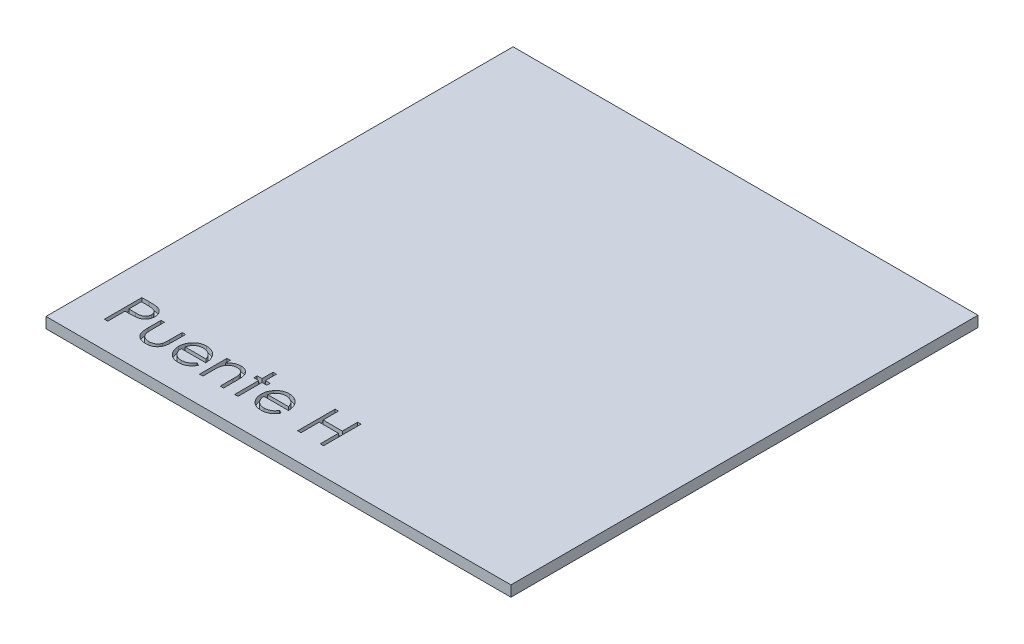
from build123d import *

# Parameters (mm, degrees)
SKETCH1_W           = 43.4
SKETCH1_H           = 43.6
BOSS_EXTRUDE1_DEPTH = 1
CUT_EXTRUDE1_DEPTH  = 0.5


with BuildPart() as part:
    # Sketch1 → Boss-Extrude1 (new body)
    with BuildSketch(Plane(origin=(0, 0, 0), x_dir=(1, 0, 0), z_dir=(0, 1, 0))):
        with Locations((21.7, 21.8)):
            Rectangle(SKETCH1_W, SKETCH1_H)
    extrude(amount=BOSS_EXTRUDE1_DEPTH)

    # Sketch2 → Cut-Extrude1 (cut)
    # profile 1 of 7: a face of its own
    with BuildSketch(Plane(origin=(0, 1, 0), x_dir=(1, 0, 0), z_dir=(0, 1, 0))):
        with BuildLine():
            Line((2.948717949, 6), (3.635116186, 6))
            add(Edge.make_bspline(
                [(3.635116186, 6), (3.682327092, 5.999948104), (3.772785285, 5.999848668), (3.902500341, 5.996833922), (4.020310072, 5.99280723), (4.125960453, 5.987225337), (4.219776551, 5.980628747), (4.301333851, 5.971376708), (4.371273407, 5.961716412), (4.413179857, 5.951895005), (4.432291667, 5.947415865)],
                knots=[0, 0, 0, 0, 1.415646017, 2.712440637, 3.8905458, 4.950247383, 5.884950622, 6.709939814, 7.411656543, 8, 8, 8, 8], degree=3))
            add(Edge.make_bspline(
                [(4.432291667, 5.947415865), (4.4564852, 5.940793916), (4.504302178, 5.927706054), (4.573203221, 5.90149233), (4.638757066, 5.870410165), (4.701188625, 5.834986225), (4.759730708, 5.793700661), (4.815256749, 5.748227043), (4.867276729, 5.697515475), (4.915498121, 5.642134735), (4.959782918, 5.583014525), (4.997912601, 5.519272295), (5.029839828, 5.451980992), (5.0572231, 5.381187421), (5.076931554, 5.306297097), (5.091778454, 5.227830385), (5.101202082, 5.145795695), (5.102104643, 5.089735827), (5.102564103, 5.061197917)],
                knots=[0, 0, 0, 0, 0.999701418, 1.975846123, 2.934577507, 3.890451536, 4.834027766, 5.787354733, 6.749476667, 7.726910423, 8.712836071, 9.690891519, 10.682875813, 11.679750201, 12.712814741, 13.765529915, 14.8625177, 16, 16, 16, 16], degree=3))
            add(Edge.make_bspline(
                [(5.102564103, 5.061197917), (5.102142678, 5.03242014), (5.101318132, 4.976114476), (5.091421847, 4.893741688), (5.078091655, 4.815023298), (5.057594603, 4.740133847), (5.03074893, 4.669518077), (4.999256877, 4.602096845), (4.961273346, 4.539017173), (4.917628517, 4.480050055), (4.869076922, 4.425140143), (4.815823984, 4.374685348), (4.758084692, 4.32898101), (4.696042543, 4.287924666), (4.629092695, 4.252468387), (4.558250541, 4.220711082), (4.482900325, 4.194040021), (4.430757811, 4.18000996), (4.404246795, 4.172876603)],
                knots=[0, 0, 0, 0, 1.121902311, 2.195077645, 3.232258892, 4.234102512, 5.217864754, 6.176164875, 7.132989551, 8.084763148, 9.034132444, 9.988522005, 10.94243251, 11.903244335, 12.886203696, 13.894208494, 14.929344452, 16, 16, 16, 16], degree=3))
            add(Edge.make_bspline(
                [(4.404246795, 4.172876603), (4.382319461, 4.168213621), (4.334264434, 4.157994427), (4.255121711, 4.14658597), (4.162976325, 4.13684837), (4.057954045, 4.129547232), (3.940149141, 4.123296864), (3.809497883, 4.11832877), (3.665743806, 4.115598916), (3.565472562, 4.115458123), (3.513120994, 4.115384615)],
                knots=[0, 0, 0, 0, 0.601384939, 1.31797006, 2.144135048, 3.087295005, 4.142315834, 5.309527816, 6.595305764, 8, 8, 8, 8], degree=3))
            Line((3.513120994, 4.115384615), (3.262820513, 4.115384615))
            Line((3.262820513, 4.115384615), (3.262820513, 2.5))
            Line((3.262820513, 2.5), (2.948717949, 2.5))
            Line((2.948717949, 2.5), (2.948717949, 6))
        make_face()
        with BuildLine():
            Line((3.262820513, 5.641025641), (3.262820513, 4.474358974))
            Line((3.262820513, 4.474358974), (3.875600962, 4.466646635))
            add(Edge.make_bspline(
                [(3.875600962, 4.466646635), (3.905520887, 4.466631171), (3.963280687, 4.466601319), (4.046716911, 4.470586542), (4.124126198, 4.475187075), (4.195270773, 4.481922998), (4.260182708, 4.491444256), (4.318970237, 4.501055994), (4.371177519, 4.514961356), (4.432276721, 4.533684426), (4.500360069, 4.565617041), (4.574427617, 4.611966931), (4.637198204, 4.67104764), (4.6915165, 4.737475471), (4.734622378, 4.8113746), (4.766178371, 4.890443537), (4.784719528, 4.973871387), (4.787205722, 5.030959525), (4.788461538, 5.059795673)],
                knots=[0, 0, 0, 0, 1.160613943, 2.240541288, 3.23993089, 4.169200891, 5.011653406, 5.7853311, 6.478053781, 7.106038997, 8.262395093, 9.384106736, 10.481365981, 11.59014053, 12.70357646, 13.786202915, 14.881775077, 16, 16, 16, 16], degree=3))
            add(Edge.make_bspline(
                [(4.788461538, 5.059795673), (4.787198892, 5.087934187), (4.784688907, 5.143870069), (4.766033044, 5.225848829), (4.73468373, 5.304084534), (4.691227135, 5.377057619), (4.638486006, 5.443246423), (4.577186662, 5.50074355), (4.507473401, 5.546965253), (4.44262517, 5.576798534), (4.385023984, 5.59501381), (4.334992024, 5.60775865), (4.27850135, 5.617934257), (4.21553357, 5.626173759), (4.146576736, 5.633227221), (4.071038421, 5.638013198), (3.989204778, 5.640814654), (3.932394207, 5.640953609), (3.902944712, 5.641025641)],
                knots=[0, 0, 0, 0, 1.120700087, 2.227813068, 3.331159281, 4.466773991, 5.599788987, 6.693661531, 7.80175334, 8.91857717, 9.525282508, 10.207424825, 10.974604443, 11.810962634, 12.737642355, 13.736264703, 14.826523623, 16, 16, 16, 16], degree=3))
            Line((3.902944712, 5.641025641), (3.262820513, 5.641025641))
        make_face(mode=Mode.SUBTRACT)
    # profile 2 of 7: a face of its own
    with BuildSketch(Plane(origin=(0, 1, 0), x_dir=(1, 0, 0), z_dir=(0, 1, 0))):
        with BuildLine():
            Line((5.685897436, 5.057692308), (6, 5.057692308))
            Line((6, 5.057692308), (6, 3.871394231))
            add(Edge.make_bspline(
                [(6, 3.871394231), (6.000141905, 3.836571482), (6.000413362, 3.769957194), (6.002254303, 3.674102007), (6.006584397, 3.586685294), (6.011998221, 3.507656557), (6.018960358, 3.437029166), (6.027243718, 3.375049809), (6.03650214, 3.321015625), (6.045564854, 3.288472269), (6.049779647, 3.27333734)],
                knots=[0, 0, 0, 0, 1.388932606, 2.656963016, 3.823490214, 4.879454478, 5.816252168, 6.653371382, 7.373723809, 8, 8, 8, 8], degree=3))
            add(Edge.make_bspline(
                [(6.049779647, 3.27333734), (6.056541102, 3.254314469), (6.069923443, 3.216664208), (6.094196927, 3.162275202), (6.124225264, 3.11189992), (6.157085092, 3.063595847), (6.194984499, 3.01879386), (6.23744397, 2.977569617), (6.283042207, 2.938365526), (6.350797231, 2.891980734), (6.443456497, 2.842265403), (6.565109252, 2.799369585), (6.697013478, 2.773733765), (6.788178197, 2.77075951), (6.835036058, 2.769230769)],
                knots=[0, 0, 0, 0, 0.725840625, 1.436591201, 2.137033971, 2.831655856, 3.53531722, 4.242432219, 4.957935707, 5.694543706, 7.190802206, 8.724350549, 10.316345118, 12, 12, 12, 12], degree=3))
            add(Edge.make_bspline(
                [(6.835036058, 2.769230769), (6.881889565, 2.770792018), (6.972542434, 2.773812745), (7.102997403, 2.798596284), (7.222248817, 2.840001973), (7.329099769, 2.897809384), (7.423065609, 2.968551447), (7.501370028, 3.051560256), (7.565977282, 3.144209643), (7.594186703, 3.213333922), (7.608373397, 3.248096955)],
                knots=[0, 0, 0, 0, 1.157059328, 2.238695713, 3.266970494, 4.264342957, 5.228770407, 6.160125903, 7.074715775, 8, 8, 8, 8], degree=3))
            add(Edge.make_bspline(
                [(7.608373397, 3.248096955), (7.612567628, 3.262063254), (7.621840046, 3.292939329), (7.631802397, 3.345319078), (7.640776859, 3.407783682), (7.648440035, 3.480741891), (7.653905198, 3.564003043), (7.656851224, 3.657541119), (7.6601795, 3.76106248), (7.660230016, 3.833530239), (7.66025641, 3.871394231)],
                knots=[0, 0, 0, 0, 0.557542046, 1.232589297, 2.036731608, 2.971723315, 4.038036528, 5.22795436, 6.551621927, 8, 8, 8, 8], degree=3))
            Line((7.66025641, 3.871394231), (7.66025641, 5.057692308))
            Line((7.66025641, 5.057692308), (7.974358974, 5.057692308))
            Line((7.974358974, 5.057692308), (7.974358974, 3.8125))
            add(Edge.make_bspline(
                [(7.974358974, 3.8125), (7.97391728, 3.770192829), (7.973060331, 3.688111129), (7.967552988, 3.568827017), (7.958103375, 3.457664772), (7.94376069, 3.354565552), (7.926895015, 3.259608071), (7.905138742, 3.172670625), (7.879160505, 3.094021071), (7.84985499, 3.022279294), (7.815233122, 2.9572324), (7.778406102, 2.895496583), (7.73588133, 2.838603648), (7.691111096, 2.783721511), (7.64130944, 2.733579983), (7.587409581, 2.687028507), (7.530170161, 2.643355476), (7.468320963, 2.604264196), (7.4027649, 2.569047551), (7.333421043, 2.537831473), (7.259440045, 2.513128896), (7.181776408, 2.49181823), (7.100049628, 2.475103761), (7.014338495, 2.463317194), (6.924671879, 2.456091863), (6.863562419, 2.455454818), (6.832231571, 2.455128205)],
                knots=[0, 0, 0, 0, 1.493040784, 2.896703357, 4.213163133, 5.428574705, 6.569057535, 7.615249723, 8.588095153, 9.490268104, 10.346124644, 11.18633936, 12.024365274, 12.850166724, 13.684164916, 14.514361689, 15.362232829, 16.222528818, 17.093394965, 17.986930858, 18.902426812, 19.842810585, 20.827885679, 21.843828298, 22.894529745, 24, 24, 24, 24], degree=3))
            add(Edge.make_bspline(
                [(6.832231571, 2.455128205), (6.801135056, 2.455467912), (6.740027511, 2.456135468), (6.650356267, 2.463277276), (6.564407661, 2.475085447), (6.482487262, 2.491940664), (6.404512865, 2.512979734), (6.330168625, 2.53798327), (6.260325062, 2.569063751), (6.194143058, 2.604041309), (6.13214067, 2.643606584), (6.074032092, 2.686974624), (6.019895239, 2.734080687), (5.969718171, 2.784728044), (5.924205195, 2.83954498), (5.882789153, 2.898090541), (5.844832448, 2.959784629), (5.810479657, 3.025847792), (5.780967902, 3.098419802), (5.754912656, 3.178716899), (5.733602018, 3.267619415), (5.716259549, 3.365051344), (5.702308109, 3.470546385), (5.692621966, 3.584714801), (5.687206136, 3.707278493), (5.686343074, 3.791928383), (5.685897436, 3.835637019)],
                knots=[0, 0, 0, 0, 1.083640291, 2.129454052, 3.13281866, 4.105697902, 5.042300162, 5.946461698, 6.836384745, 7.703652036, 8.553297018, 9.397182691, 10.228592656, 11.052265423, 11.879314572, 12.708807002, 13.549817954, 14.402308542, 15.300838682, 16.27712199, 17.341985831, 18.484375296, 19.725102775, 21.0496083, 22.476576903, 24, 24, 24, 24], degree=3))
            Line((5.685897436, 3.835637019), (5.685897436, 5.057692308))
        make_face()
    # profile 3 of 7: a face of its own
    with BuildSketch(Plane(origin=(0, 1, 0), x_dir=(1, 0, 0), z_dir=(0, 1, 0))):
        with BuildLine():
            Line((10.791466346, 3.307692308), (11.070512821, 3.161157853))
            add(Edge.make_bspline(
                [(11.070512821, 3.161157853), (11.048276225, 3.121714521), (11.005012617, 3.044973418), (10.930611869, 2.939541558), (10.852619796, 2.844693842), (10.767515828, 2.762964188), (10.677846149, 2.691712803), (10.583113495, 2.629374978), (10.482824677, 2.576256458), (10.376974952, 2.53150393), (10.264675401, 2.497094436), (10.145653885, 2.472790215), (10.019682389, 2.457766946), (9.933336209, 2.456021806), (9.889122596, 2.455128205)],
                knots=[0, 0, 0, 0, 1.120438281, 2.179929193, 3.190490725, 4.156257408, 5.095198341, 6.022838206, 6.959905092, 7.901321166, 8.864066838, 9.862729781, 10.905609505, 12, 12, 12, 12], degree=3))
            add(Edge.make_bspline(
                [(9.889122596, 2.455128205), (9.839980619, 2.45627538), (9.744118857, 2.458513187), (9.60457911, 2.477805652), (9.473199691, 2.50927801), (9.349987988, 2.553243552), (9.235245736, 2.610670876), (9.128744881, 2.680630358), (9.029925355, 2.762762612), (8.941901146, 2.857779056), (8.862657263, 2.959461013), (8.792731443, 3.065416898), (8.734274012, 3.175380122), (8.686721402, 3.288650646), (8.648316537, 3.40451454), (8.621549833, 3.524026007), (8.606120085, 3.646861592), (8.603755639, 3.729958927), (8.602564103, 3.771834936)],
                knots=[0, 0, 0, 0, 1.145258523, 2.234067595, 3.276747158, 4.290159414, 5.277019952, 6.260822364, 7.254936242, 8.264827045, 9.274100331, 10.257902744, 11.220704747, 12.172965371, 13.118907548, 14.062713208, 15.023725156, 16, 16, 16, 16], degree=3))
            add(Edge.make_bspline(
                [(8.602564103, 3.771834936), (8.603623244, 3.811129766), (8.605722322, 3.889006931), (8.61895311, 4.004272476), (8.642401403, 4.116300928), (8.674577727, 4.225185376), (8.716128973, 4.33074351), (8.766961192, 4.433039574), (8.82715357, 4.531964713), (8.873626243, 4.594367847), (8.897035256, 4.625801282)],
                knots=[0, 0, 0, 0, 1.024358464, 2.0301432, 3.019427413, 4.004406732, 4.986367066, 5.972626655, 6.978780325, 8, 8, 8, 8], degree=3))
            add(Edge.make_bspline(
                [(8.897035256, 4.625801282), (8.928742939, 4.663670152), (8.991153886, 4.738208303), (9.096710241, 4.836146628), (9.211010437, 4.918190404), (9.332622064, 4.98619754), (9.462958538, 5.037871187), (9.600267829, 5.076378769), (9.746113415, 5.09795678), (9.845818636, 5.101004614), (9.896834936, 5.102564103)],
                knots=[0, 0, 0, 0, 1.030682036, 2.02871468, 2.997146059, 3.962720338, 4.930598197, 5.918074684, 6.934738563, 8, 8, 8, 8], degree=3))
            add(Edge.make_bspline(
                [(9.896834936, 5.102564103), (9.949282541, 5.101210054), (10.052172787, 5.098553718), (10.202204908, 5.073927385), (10.344165625, 5.03487483), (10.477998129, 4.97972104), (10.60371599, 4.908561488), (10.720502039, 4.820419647), (10.830353552, 4.718001559), (10.894262131, 4.63923835), (10.926782853, 4.599158654)],
                knots=[0, 0, 0, 0, 1.056321875, 2.072262726, 3.055038591, 4.01806755, 4.982017516, 5.957941055, 6.960871419, 8, 8, 8, 8], degree=3))
            add(Edge.make_bspline(
                [(10.926782853, 4.599158654), (10.948909791, 4.568955072), (10.993016384, 4.508748954), (11.048263484, 4.410577797), (11.096220879, 4.307867202), (11.13455384, 4.198956905), (11.165593341, 4.085137325), (11.18805016, 3.96559478), (11.201219779, 3.840364869), (11.203808476, 3.755038314), (11.205128205, 3.711538462)],
                knots=[0, 0, 0, 0, 0.94817472, 1.890038105, 2.849395472, 3.817997239, 4.812318967, 5.836947057, 6.897266129, 8, 8, 8, 8], degree=3))
            Line((11.205128205, 3.711538462), (8.916666667, 3.711538462))
            add(Edge.make_bspline(
                [(8.916666667, 3.711538462), (8.918206273, 3.677837997), (8.921233847, 3.611567394), (8.93534899, 3.51459661), (8.957597764, 3.422223268), (8.988866827, 3.335140226), (9.026733672, 3.252210099), (9.073119389, 3.174048062), (9.128458943, 3.101010132), (9.190184642, 3.032442994), (9.258891737, 2.971382233), (9.331174485, 2.916730457), (9.40806805, 2.87092486), (9.488966133, 2.83374497), (9.573737918, 2.804638654), (9.662410113, 2.784770834), (9.75480823, 2.771463727), (9.817793964, 2.769984061), (9.849859776, 2.769230769)],
                knots=[0, 0, 0, 0, 1.094153842, 2.151609401, 3.174256925, 4.172055639, 5.149267565, 6.128595816, 7.11444997, 8.118368179, 9.117203808, 10.09244225, 11.054858984, 12.015122123, 12.976791628, 13.957293641, 14.960065497, 16, 16, 16, 16], degree=3))
            add(Edge.make_bspline(
                [(9.849859776, 2.769230769), (9.881210923, 2.769838826), (9.943417614, 2.771045327), (10.036058472, 2.782777238), (10.127197999, 2.801747513), (10.216458982, 2.827637504), (10.302029828, 2.859214356), (10.381275378, 2.897317213), (10.454155594, 2.93946696), (10.52227256, 2.987676635), (10.588343554, 3.046684822), (10.65388604, 3.120320543), (10.724162694, 3.207408071), (10.768152286, 3.272953737), (10.791466346, 3.307692308)],
                knots=[0, 0, 0, 0, 0.99110716, 1.966546729, 2.947904876, 3.932708344, 4.903319531, 5.828989031, 6.710028674, 7.56322171, 8.463672341, 9.504779593, 10.677557249, 12, 12, 12, 12], degree=3))
        make_face()
        with BuildLine():
            add(Edge.make_bspline(
                [(10.891025641, 4.025641026), (10.879529016, 4.067303899), (10.857401715, 4.14749152), (10.811165351, 4.25853241), (10.75909381, 4.357220311), (10.697472078, 4.442799944), (10.627653353, 4.518803457), (10.54700817, 4.585222043), (10.456572277, 4.644639494), (10.356813136, 4.694791993), (10.251171351, 4.737481852), (10.140565159, 4.766106968), (10.027707371, 4.78571651), (9.951373085, 4.787542618), (9.912960737, 4.788461538)],
                knots=[0, 0, 0, 0, 1.154881502, 2.222775134, 3.210006277, 4.132804581, 5.035138423, 5.962687519, 6.919655026, 7.923214229, 8.944639381, 9.960483929, 10.97369054, 12, 12, 12, 12], degree=3))
            add(Edge.make_bspline(
                [(9.912960737, 4.788461538), (9.881611299, 4.787849867), (9.81964005, 4.786640721), (9.728338981, 4.775170592), (9.640659282, 4.756210747), (9.555953995, 4.73024579), (9.475333127, 4.695637188), (9.397138358, 4.655053961), (9.323357962, 4.605512377), (9.277216667, 4.567753522), (9.25390625, 4.548677885)],
                knots=[0, 0, 0, 0, 1.04873581, 2.073130211, 3.073294108, 4.04793562, 5.032784715, 6.005352987, 6.992311501, 8, 8, 8, 8], degree=3))
            add(Edge.make_bspline(
                [(9.25390625, 4.548677885), (9.237212968, 4.533583569), (9.203429834, 4.503036353), (9.158289312, 4.450407146), (9.11506884, 4.393655584), (9.075735187, 4.33061046), (9.0396576, 4.261989681), (9.005897623, 4.188372045), (8.975511211, 4.109198915), (8.958415101, 4.054026476), (8.949619391, 4.025641026)],
                knots=[0, 0, 0, 0, 0.879870761, 1.780643979, 2.707998968, 3.669668524, 4.684282772, 5.740141944, 6.837334558, 8, 8, 8, 8], degree=3))
            Line((8.949619391, 4.025641026), (10.891025641, 4.025641026))
        make_face(mode=Mode.SUBTRACT)
    # profile 4 of 7: a face of its own
    with BuildSketch(Plane(origin=(0, 1, 0), x_dir=(1, 0, 0), z_dir=(0, 1, 0))):
        with BuildLine():
            Line((11.833333333, 5.057692308), (12.147435897, 5.057692308))
            Line((12.147435897, 5.057692308), (12.147435897, 4.596354167))
            add(Edge.make_bspline(
                [(12.147435897, 4.596354167), (12.180973533, 4.63819689), (12.246054484, 4.719394153), (12.354438817, 4.826114728), (12.468982717, 4.914059953), (12.588984721, 4.984163747), (12.714607731, 5.037010373), (12.845086001, 5.075176304), (12.981200707, 5.098061132), (13.073765144, 5.101051363), (13.120592949, 5.102564103)],
                knots=[0, 0, 0, 0, 1.12780773, 2.188550248, 3.19190651, 4.159438251, 5.104880172, 6.052711206, 7.014878035, 8, 8, 8, 8], degree=3))
            add(Edge.make_bspline(
                [(13.120592949, 5.102564103), (13.167923583, 5.100818907), (13.260561051, 5.097403139), (13.395439112, 5.070386448), (13.521412506, 5.024241192), (13.638032061, 4.961029122), (13.743159275, 4.882422649), (13.835484126, 4.790844867), (13.911847374, 4.685508784), (13.963044737, 4.587785627), (13.996770384, 4.501096833), (14.018002722, 4.426850083), (14.036033703, 4.344131932), (14.051665451, 4.253192343), (14.062242563, 4.153394153), (14.070584855, 4.045146461), (14.076563549, 3.92848433), (14.076800756, 3.847797703), (14.076923077, 3.806189904)],
                knots=[0, 0, 0, 0, 1.235846778, 2.418850247, 3.575807741, 4.728682307, 5.871620074, 6.994088408, 8.11269785, 9.256955736, 9.865816715, 10.540099792, 11.271859618, 12.076849838, 12.949306005, 13.892391288, 14.913166135, 16, 16, 16, 16], degree=3))
            Line((14.076923077, 3.806189904), (14.076923077, 2.5))
            Line((14.076923077, 2.5), (13.762820513, 2.5))
            Line((13.762820513, 2.5), (13.762820513, 3.703125))
            add(Edge.make_bspline(
                [(13.762820513, 3.703125), (13.762627305, 3.737947445), (13.762257731, 3.804556856), (13.761092084, 3.899925879), (13.758282277, 3.986412457), (13.754333965, 4.063809825), (13.748554934, 4.132043661), (13.742532303, 4.191252938), (13.735167326, 4.24136248), (13.728604413, 4.271527563), (13.725661058, 4.28505609)],
                knots=[0, 0, 0, 0, 1.430800155, 2.736877192, 3.918605307, 4.986035426, 5.920637409, 6.731861385, 7.431261377, 8, 8, 8, 8], degree=3))
            add(Edge.make_bspline(
                [(13.725661058, 4.28505609), (13.715035526, 4.324767275), (13.694584666, 4.401199019), (13.644050682, 4.504873372), (13.580236502, 4.59307156), (13.502338652, 4.665248281), (13.411109577, 4.721419118), (13.306802434, 4.760393073), (13.190423793, 4.784769342), (13.10856941, 4.787196474), (13.065905449, 4.788461538)],
                knots=[0, 0, 0, 0, 1.084156227, 2.086665306, 3.027808233, 3.945421172, 4.874247719, 5.839848303, 6.874090471, 8, 8, 8, 8], degree=3))
            add(Edge.make_bspline(
                [(13.065905449, 4.788461538), (13.040637765, 4.787985534), (12.990633672, 4.787043533), (12.9164837, 4.777592235), (12.844559527, 4.762133779), (12.774139318, 4.741265142), (12.706631524, 4.712602873), (12.639867233, 4.680073502), (12.576360469, 4.63952529), (12.514757072, 4.594334669), (12.457444264, 4.544255462), (12.404115926, 4.491410952), (12.356577906, 4.435135348), (12.31350923, 4.3763354), (12.276330967, 4.314203562), (12.243877879, 4.249339256), (12.216342184, 4.181657107), (12.202659492, 4.134682046), (12.195813301, 4.111177885)],
                knots=[0, 0, 0, 0, 1.023777757, 2.026029729, 3.023749952, 4.003683103, 4.997618607, 5.993177895, 7.010360494, 8.046726602, 9.087585522, 10.09234134, 11.086953743, 12.070360549, 13.043493632, 14.017870808, 15.008233677, 16, 16, 16, 16], degree=3))
            add(Edge.make_bspline(
                [(12.195813301, 4.111177885), (12.191873653, 4.093922682), (12.183297244, 4.056359007), (12.174034064, 3.994714588), (12.165626489, 3.923404613), (12.15858953, 3.842512296), (12.154284113, 3.751754421), (12.149589717, 3.651518583), (12.147880656, 3.541405094), (12.147588302, 3.464743402), (12.147435897, 3.424779647)],
                knots=[0, 0, 0, 0, 0.615963638, 1.340920617, 2.168419149, 3.115676021, 4.16674242, 5.331190069, 6.6087489, 8, 8, 8, 8], degree=3))
            Line((12.147435897, 3.424779647), (12.147435897, 2.5))
            Line((12.147435897, 2.5), (11.833333333, 2.5))
            Line((11.833333333, 2.5), (11.833333333, 5.057692308))
        make_face()
    # profile 5 of 7: a face of its own
    with BuildSketch(Plane(origin=(0, 1, 0), x_dir=(1, 0, 0), z_dir=(0, 1, 0))):
        Polygon((15.108974359, 6.08974359), (15.423076923, 6.08974359), (15.423076923, 5.057692308), (15.871794872, 5.057692308), (15.871794872, 4.743589744), (15.423076923, 4.743589744), (15.423076923, 2.5), (15.108974359, 2.5), (15.108974359, 4.743589744), (14.66025641, 4.743589744), (14.66025641, 5.057692308), (15.108974359, 5.057692308), align=None)
    # profile 6 of 7: a face of its own
    with BuildSketch(Plane(origin=(0, 1, 0), x_dir=(1, 0, 0), z_dir=(0, 1, 0))):
        with BuildLine():
            Line((18.509415064, 3.307692308), (18.788461538, 3.161157853))
            add(Edge.make_bspline(
                [(18.788461538, 3.161157853), (18.766224943, 3.121714521), (18.722961335, 3.044973418), (18.648560587, 2.939541558), (18.570568514, 2.844693842), (18.485464546, 2.762964188), (18.395794867, 2.691712803), (18.301062213, 2.629374978), (18.200773395, 2.576256458), (18.09492367, 2.53150393), (17.982624119, 2.497094436), (17.863602602, 2.472790215), (17.737631107, 2.457766946), (17.651284927, 2.456021806), (17.607071314, 2.455128205)],
                knots=[0, 0, 0, 0, 1.120438281, 2.179929193, 3.190490725, 4.156257408, 5.095198341, 6.022838206, 6.959905092, 7.901321166, 8.864066838, 9.862729781, 10.905609505, 12, 12, 12, 12], degree=3))
            add(Edge.make_bspline(
                [(17.607071314, 2.455128205), (17.557929337, 2.45627538), (17.462067575, 2.458513187), (17.322527828, 2.477805652), (17.191148409, 2.50927801), (17.067936706, 2.553243552), (16.953194453, 2.610670876), (16.846693599, 2.680630358), (16.747874073, 2.762762612), (16.659849864, 2.857779056), (16.580605981, 2.959461013), (16.510680161, 3.065416898), (16.45222273, 3.175380122), (16.40467012, 3.288650646), (16.366265255, 3.40451454), (16.339498551, 3.524026007), (16.324068803, 3.646861592), (16.321704357, 3.729958927), (16.320512821, 3.771834936)],
                knots=[0, 0, 0, 0, 1.145258523, 2.234067595, 3.276747158, 4.290159414, 5.277019952, 6.260822364, 7.254936242, 8.264827045, 9.274100331, 10.257902744, 11.220704747, 12.172965371, 13.118907548, 14.062713208, 15.023725156, 16, 16, 16, 16], degree=3))
            add(Edge.make_bspline(
                [(16.320512821, 3.771834936), (16.321571962, 3.811129766), (16.32367104, 3.889006931), (16.336901827, 4.004272476), (16.360350121, 4.116300928), (16.392526445, 4.225185376), (16.434077691, 4.33074351), (16.48490991, 4.433039574), (16.545102288, 4.531964713), (16.591574961, 4.594367847), (16.614983974, 4.625801282)],
                knots=[0, 0, 0, 0, 1.024358464, 2.0301432, 3.019427413, 4.004406732, 4.986367066, 5.972626655, 6.978780325, 8, 8, 8, 8], degree=3))
            add(Edge.make_bspline(
                [(16.614983974, 4.625801282), (16.646691657, 4.663670152), (16.709102604, 4.738208303), (16.814658959, 4.836146628), (16.928959155, 4.918190404), (17.050570782, 4.98619754), (17.180907256, 5.037871187), (17.318216547, 5.076378769), (17.464062133, 5.09795678), (17.563767354, 5.101004614), (17.614783654, 5.102564103)],
                knots=[0, 0, 0, 0, 1.030682036, 2.02871468, 2.997146059, 3.962720338, 4.930598197, 5.918074684, 6.934738563, 8, 8, 8, 8], degree=3))
            add(Edge.make_bspline(
                [(17.614783654, 5.102564103), (17.667231259, 5.101210054), (17.770121505, 5.098553718), (17.920153626, 5.073927385), (18.062114343, 5.03487483), (18.195946847, 4.97972104), (18.321664708, 4.908561488), (18.438450757, 4.820419647), (18.54830227, 4.718001559), (18.612210849, 4.63923835), (18.644731571, 4.599158654)],
                knots=[0, 0, 0, 0, 1.056321875, 2.072262726, 3.055038591, 4.01806755, 4.982017516, 5.957941055, 6.960871419, 8, 8, 8, 8], degree=3))
            add(Edge.make_bspline(
                [(18.644731571, 4.599158654), (18.666858509, 4.568955072), (18.710965102, 4.508748954), (18.766212202, 4.410577797), (18.814169597, 4.307867202), (18.852502558, 4.198956905), (18.883542059, 4.085137325), (18.905998878, 3.96559478), (18.919168496, 3.840364869), (18.921757194, 3.755038314), (18.923076923, 3.711538462)],
                knots=[0, 0, 0, 0, 0.94817472, 1.890038105, 2.849395472, 3.817997239, 4.812318967, 5.836947057, 6.897266129, 8, 8, 8, 8], degree=3))
            Line((18.923076923, 3.711538462), (16.634615385, 3.711538462))
            add(Edge.make_bspline(
                [(16.634615385, 3.711538462), (16.636154991, 3.677837997), (16.639182565, 3.611567394), (16.653297708, 3.51459661), (16.675546482, 3.422223268), (16.706815545, 3.335140226), (16.74468239, 3.252210099), (16.791068107, 3.174048062), (16.846407661, 3.101010132), (16.90813336, 3.032442994), (16.976840455, 2.971382233), (17.049123203, 2.916730457), (17.126016767, 2.87092486), (17.206914851, 2.83374497), (17.291686636, 2.804638654), (17.380358831, 2.784770834), (17.472756948, 2.771463727), (17.535742682, 2.769984061), (17.567808494, 2.769230769)],
                knots=[0, 0, 0, 0, 1.094153842, 2.151609401, 3.174256925, 4.172055639, 5.149267565, 6.128595816, 7.11444997, 8.118368179, 9.117203808, 10.09244225, 11.054858984, 12.015122123, 12.976791628, 13.957293641, 14.960065497, 16, 16, 16, 16], degree=3))
            add(Edge.make_bspline(
                [(17.567808494, 2.769230769), (17.599159641, 2.769838826), (17.661366332, 2.771045327), (17.754007189, 2.782777238), (17.845146717, 2.801747513), (17.9344077, 2.827637504), (18.019978546, 2.859214356), (18.099224096, 2.897317213), (18.172104312, 2.93946696), (18.240221278, 2.987676635), (18.306292272, 3.046684822), (18.371834758, 3.120320543), (18.442111411, 3.207408071), (18.486101004, 3.272953737), (18.509415064, 3.307692308)],
                knots=[0, 0, 0, 0, 0.99110716, 1.966546729, 2.947904876, 3.932708344, 4.903319531, 5.828989031, 6.710028674, 7.56322171, 8.463672341, 9.504779593, 10.677557249, 12, 12, 12, 12], degree=3))
        make_face()
        with BuildLine():
            add(Edge.make_bspline(
                [(18.608974359, 4.025641026), (18.597477734, 4.067303899), (18.575350433, 4.14749152), (18.529114068, 4.25853241), (18.477042528, 4.357220311), (18.415420796, 4.442799944), (18.345602071, 4.518803457), (18.264956888, 4.585222043), (18.174520995, 4.644639494), (18.074761854, 4.694791993), (17.969120069, 4.737481852), (17.858513877, 4.766106968), (17.745656089, 4.78571651), (17.669321803, 4.787542618), (17.630909455, 4.788461538)],
                knots=[0, 0, 0, 0, 1.154881502, 2.222775134, 3.210006277, 4.132804581, 5.035138423, 5.962687519, 6.919655026, 7.923214229, 8.944639381, 9.960483929, 10.97369054, 12, 12, 12, 12], degree=3))
            add(Edge.make_bspline(
                [(17.630909455, 4.788461538), (17.599560017, 4.787849867), (17.537588768, 4.786640721), (17.446287699, 4.775170592), (17.358608, 4.756210747), (17.273902713, 4.73024579), (17.193281844, 4.695637188), (17.115087076, 4.655053961), (17.04130668, 4.605512377), (16.995165385, 4.567753522), (16.971854968, 4.548677885)],
                knots=[0, 0, 0, 0, 1.04873581, 2.073130211, 3.073294108, 4.04793562, 5.032784715, 6.005352987, 6.992311501, 8, 8, 8, 8], degree=3))
            add(Edge.make_bspline(
                [(16.971854968, 4.548677885), (16.955161686, 4.533583569), (16.921378552, 4.503036353), (16.87623803, 4.450407146), (16.833017558, 4.393655584), (16.793683905, 4.33061046), (16.757606318, 4.261989681), (16.723846341, 4.188372045), (16.693459929, 4.109198915), (16.676363819, 4.054026476), (16.667568109, 4.025641026)],
                knots=[0, 0, 0, 0, 0.879870761, 1.780643979, 2.707998968, 3.669668524, 4.684282772, 5.740141944, 6.837334558, 8, 8, 8, 8], degree=3))
            Line((16.667568109, 4.025641026), (18.608974359, 4.025641026))
        make_face(mode=Mode.SUBTRACT)
    # profile 7 of 7: a face of its own
    with BuildSketch(Plane(origin=(0, 1, 0), x_dir=(1, 0, 0), z_dir=(0, 1, 0))):
        Polygon((20.987179487, 6), (21.301282051, 6), (21.301282051, 4.564102564), (23.096153846, 4.564102564), (23.096153846, 6), (23.41025641, 6), (23.41025641, 2.5), (23.096153846, 2.5), (23.096153846, 4.205128205), (21.301282051, 4.205128205), (21.301282051, 2.5), (20.987179487, 2.5), align=None)
    extrude(amount=-CUT_EXTRUDE1_DEPTH, mode=Mode.SUBTRACT)


solid = part.part
